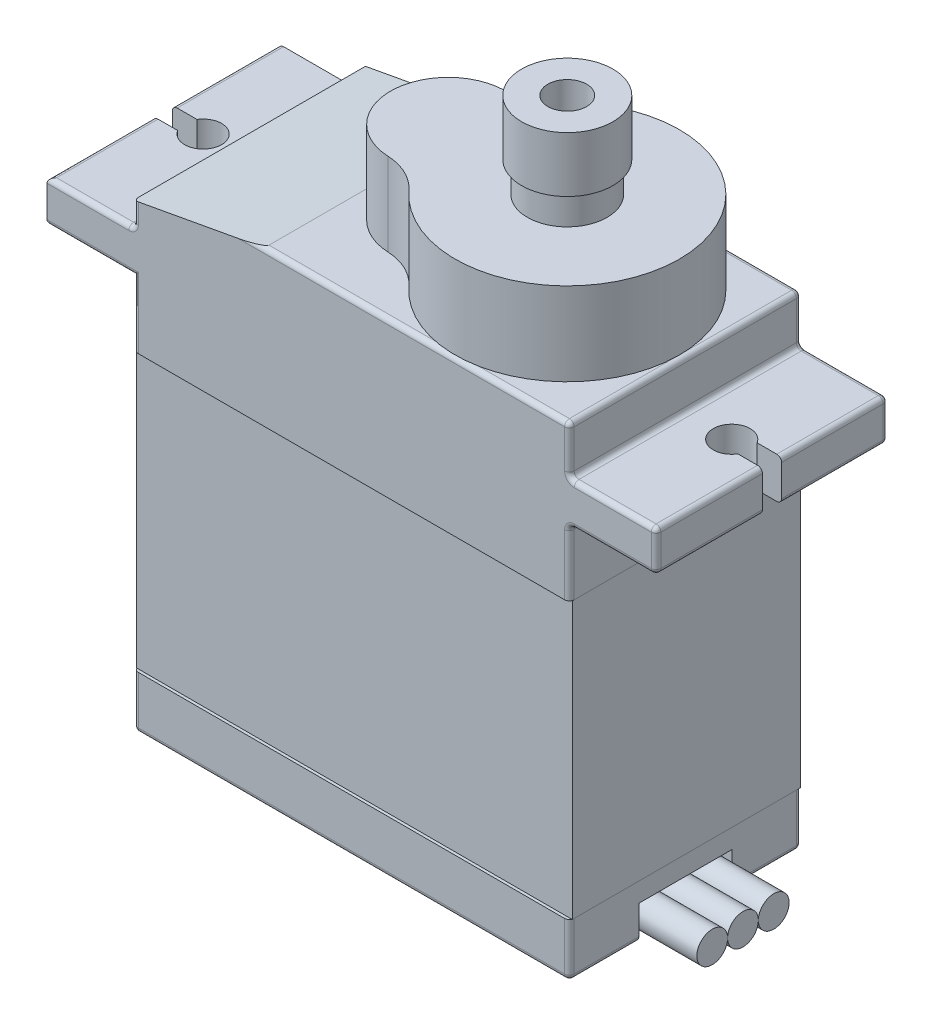
from build123d import *

# Parameters (mm, degrees)
CROQUIS1_W                   = 22.67
CROQUIS1_H                   = 12.06
SALIENTE_EXTRUIR1_DEPTH      = 25.15
CROQUIS2_W                   = 12.06
CROQUIS2_H                   = 2.13
SALIENTE_EXTRUIR2_DEPTH      = 4.51
CROQUIS5_W                   = 12.06
CROQUIS5_H                   = 2.13
SALIENTE_EXTRUIR3_DEPTH      = 4.51
REDONDEO1_R                  = 0.25
CORTAR_EXTRUIR12_DEPTH       = 4.51
SALIENTE_EXTRUIR4_DEPTH      = 4.32
CROQUIS9_R                   = 2.075
SALIENTE_EXTRUIR5_DEPTH      = 1.58
CROQUIS10_R                  = 2.385
SALIENTE_EXTRUIR6_DEPTH      = 2.88
CROQUIS11_R                  = 1.01
CORTAR_EXTRUIR13_DEPTH       = 3.88
CROQUIS12_R                  = 2.385
CROQUIS12_R_2                = 2.375
CORTAR_EXTRUIR14_DEPTH       = 2.88
CORTAR_EXTRUIR15_DEPTH       = 16.88
CROQUIS14_W                  = 22.17
CROQUIS14_H                  = 14.33
CORTAR_EXTRUIR16_DEPTH       = 16.88
CROQUIS16_W                  = 11.56
CROQUIS16_H                  = 14.354716837
CORTAR_EXTRUIR17_DEPTH       = 27.88
CORTAR_EXTRUIR18_DEPTH       = 27.88
CORTAR_EXTRUIR18_DEPTH_BACK  = 27.88
CROQUIS17_W                  = 22.67
CROQUIS17_H                  = 14.354716837
SALIENTE_EXTRUIR7_DEPTH      = 5.88
SALIENTE_EXTRUIR7_DEPTH_BACK = 6
CROQUIS18_W                  = 22.67
CROQUIS18_H                  = 14.354716837
CROQUIS19_W                  = 4.84
CROQUIS19_H                  = 1.754840309
CORTAR_EXTRUIR19_DEPTH       = 1.6
SALIENTE_EXTRUIR8_DEPTH      = 4.6
CROQUIS20_R                  = 0.8
SALIENTE_EXTRUIR8_2_DEPTH    = 4.6
SALIENTE_EXTRUIR8_3_DEPTH    = 4.6


with BuildPart() as part:
    # Croquis1 → Saliente-Extruir1 (new body)
    with BuildSketch(Plane(origin=(0, 0, 0), x_dir=(1, 0, 0), z_dir=(0, 1, 0))):
        Rectangle(CROQUIS1_W, CROQUIS1_H)
    extrude(amount=SALIENTE_EXTRUIR1_DEPTH)

    # Croquis2 → Saliente-Extruir2 (add)
    with BuildSketch(Plane(origin=(11.335, 0, 0), x_dir=(0, 0, -1), z_dir=(1, 0, 0))):
        with Locations((0, 21.595)):
            Rectangle(CROQUIS2_W, CROQUIS2_H)
    extrude(amount=SALIENTE_EXTRUIR2_DEPTH)

    # Croquis5 → Saliente-Extruir3 (add)
    with BuildSketch(Plane.ZY.offset(11.335)):
        with Locations((0, 21.595)):
            Rectangle(CROQUIS5_W, CROQUIS5_H)
    extrude(amount=SALIENTE_EXTRUIR3_DEPTH)

    # Redondeo1
    redondeo1_edges = [part.edges().sort_by_distance(p)[0] for p in [
        (-11.335, 23.905, 6.03),
        (11.335, 10.265, 6.03),
        (11.335, 23.905, 6.03),
        (11.335, 23.905, -6.03),
        (11.335, 10.265, -6.03),
        (11.335, 0, 0),
        (0, 0, -6.03),
        (0, 0, 6.03),
        (-11.335, 0, 0),
        (-11.335, 10.265, -6.03),
        (-11.335, 10.265, 6.03),
        (-13.59, 20.53, 6.03),
        (-13.59, 22.66, 6.03),
        (0, 25.15, -6.03),
        (0, 25.15, 6.03),
        (-11.335, 22.66, 0),
        (-11.335, 25.15, 0),
        (11.335, 25.15, 0),
        (13.59, 20.53, 6.03),
        (13.59, 22.66, 6.03),
        (13.59, 22.66, -6.03),
        (13.59, 20.53, -6.03),
        (11.335, 20.53, 0),
        (11.335, 22.66, 0),
        (15.845, 21.595, -6.03),
        (15.845, 21.595, 6.03),
        (15.845, 20.53, 0),
        (15.845, 22.66, 0),
        (-15.845, 20.53, 0),
        (-15.845, 22.66, 0),
    ]]
    fillet(redondeo1_edges, radius=REDONDEO1_R)

    # Croquis6 → Cortar-Extruir12 (cut)
    with BuildSketch(Plane(origin=(0, 22.66, 0), x_dir=(1, 0, 0), z_dir=(0, 1, 0))):
        with BuildLine():
            Line((-14.56951205, 0.5), (-16.56951205, 0.5))
            Line((-16.56951205, 0.5), (-16.56951205, -0.5))
            Line((-16.56951205, -0.5), (-14.56951205, -0.5))
            ThreePointArc((-14.56951205, -0.5), (-12.79, 0), (-14.56951205, 0.5))
        make_face()
        with BuildLine():
            Line((14.56951205, 0.5), (16.56951205, 0.5))
            Line((16.56951205, 0.5), (16.56951205, -0.5))
            Line((16.56951205, -0.5), (14.56951205, -0.5))
            ThreePointArc((14.56951205, -0.5), (12.79, 0), (14.56951205, 0.5))
        make_face()
    extrude(amount=-CORTAR_EXTRUIR12_DEPTH, mode=Mode.SUBTRACT)

    # Croquis13 → Cortar-Extruir15 (cut)
    with BuildSketch(Plane.XY.offset(6.03)):
        Polygon((-4.540532383, 25.15), (-11.335, 23.905), (-11.335, 25.15), align=None)
    extrude(amount=-CORTAR_EXTRUIR15_DEPTH, mode=Mode.SUBTRACT)

    # Croquis14 → Cortar-Extruir16 (cut)
    with BuildSketch(Plane.XY.offset(6.03)):
        with Locations((0, 9.935)):
            Rectangle(CROQUIS14_W, CROQUIS14_H)
    extrude(amount=-CORTAR_EXTRUIR16_DEPTH, mode=Mode.SUBTRACT)

    # Croquis16 → Cortar-Extruir17 (cut)
    with BuildSketch(Plane.ZY.offset(11.335)):
        with Locations((0, 9.932198727)):
            Rectangle(CROQUIS16_W, CROQUIS16_H)
    extrude(amount=-CORTAR_EXTRUIR17_DEPTH, mode=Mode.SUBTRACT)

    # Croquis17 → Cortar-Extruir18 (cut, two sides: drawn at the far end of the back side and taken through both)
    with BuildSketch(Plane.XY.offset(-CORTAR_EXTRUIR18_DEPTH_BACK)):
        with Locations((0, 9.932198727)):
            Rectangle(CROQUIS17_W, CROQUIS17_H)
    extrude(amount=CORTAR_EXTRUIR18_DEPTH + CORTAR_EXTRUIR18_DEPTH_BACK, mode=Mode.SUBTRACT)


with BuildPart() as body_2:
    # Croquis8 → Saliente-Extruir4 (new body)
    with BuildSketch(Plane(origin=(0, 25.15, 0), x_dir=(1, 0, 0), z_dir=(0, 1, 0))):
        with BuildLine():
            ThreePointArc((0.929343711, -3.976626478), (11.084774082, -0.106346012), (0.999028124, 3.942056806))
            ThreePointArc((0.999028124, 3.942056806), (0.046671675, 3.262297983), (-1.093280765, 2.998549432))
            ThreePointArc((-1.093280765, 2.998549432), (-3.999883847, 0.026398978), (-1.146036702, -2.996443439))
            ThreePointArc((-1.146036702, -2.996443439), (-0.01090242, -3.280212753), (0.929343711, -3.976626478))
        make_face()
    extrude(amount=SALIENTE_EXTRUIR4_DEPTH)


with BuildPart() as body_3:
    # Croquis9 → Saliente-Extruir5 (new body)
    with BuildSketch(Plane(origin=(0, 29.47, 0), x_dir=(1, 0, 0), z_dir=(0, 1, 0))):
        with Locations((5.25, -0.055)):
            Circle(CROQUIS9_R)
    extrude(amount=SALIENTE_EXTRUIR5_DEPTH)


with BuildPart() as body_4:
    # Croquis10 → Saliente-Extruir6 (new body)
    with BuildSketch(Plane(origin=(0, 31.05, 0), x_dir=(1, 0, 0), z_dir=(0, 1, 0))):
        with Locations((5.25, -0.055)):
            Circle(CROQUIS10_R)
    extrude(amount=SALIENTE_EXTRUIR6_DEPTH)


with BuildPart() as cortar_extruir13_tool:
    # Croquis11 → Cortar-Extruir13 (new body)
    with BuildSketch(Plane(origin=(0, 33.93, 0), x_dir=(1, 0, 0), z_dir=(0, 1, 0))):
        with Locations((5.25, -0.055)):
            Circle(CROQUIS11_R)
    extrude(amount=-CORTAR_EXTRUIR13_DEPTH)


with BuildPart() as body_3_1:
    add(body_3.part)

    # Cortar-Extruir13: cut by cortar_extruir13_tool
    add(cortar_extruir13_tool.part, mode=Mode.SUBTRACT)


with BuildPart() as body_4_1:
    add(body_4.part)

    # Cortar-Extruir13: cut by cortar_extruir13_tool
    add(cortar_extruir13_tool.part, mode=Mode.SUBTRACT)

    # Croquis12 → Cortar-Extruir14 (cut)
    with BuildSketch(Plane(origin=(0, 33.93, 0), x_dir=(1, 0, 0), z_dir=(0, 1, 0))):
        with Locations((5.25, -0.055)):
            Circle(CROQUIS12_R)
        with Locations((5.25, -0.055)):
            Circle(CROQUIS12_R_2, mode=Mode.SUBTRACT)
    extrude(amount=-CORTAR_EXTRUIR14_DEPTH, mode=Mode.SUBTRACT)


with BuildPart() as cortar_extruir18_piece_1:
    # of the separate pieces the step leaves, piece 1, a body of its own (cortar_extruir18_pieces)
    add(part.part.solids().sort_by_distance((-11.085, 17.109557146, -6.03))[0])


with BuildPart() as cortar_extruir18_piece_2:
    # of the separate pieces the step leaves, piece 2, a body of its own (cortar_extruir18_pieces)
    add(part.part.solids().sort_by_distance((11.085, 0.25, -6.03))[0])

    # Croquis19 → Cortar-Extruir19 (cut)
    with BuildSketch(Plane(origin=(11.335, 0, 0), x_dir=(0, 0, -1), z_dir=(1, 0, 0))):
        with Locations((0, 0.877420155)):
            Rectangle(CROQUIS19_W, CROQUIS19_H)
    extrude(amount=-CORTAR_EXTRUIR19_DEPTH, mode=Mode.SUBTRACT)


with BuildPart() as body_6:
    # Croquis18 → Saliente-Extruir7 (new, two sides: drawn at the far end of the back side and taken through both)
    with BuildSketch(Plane.XY.offset(-SALIENTE_EXTRUIR7_DEPTH_BACK)):
        with Locations((0, 9.932198727)):
            Rectangle(CROQUIS18_W, CROQUIS18_H)
    extrude(amount=SALIENTE_EXTRUIR7_DEPTH + SALIENTE_EXTRUIR7_DEPTH_BACK)


with BuildPart() as body_7:
    # Croquis20 → Saliente-Extruir8 (new body)
    with BuildSketch(Plane(origin=(9.735, 0, 0), x_dir=(0, 0, -1), z_dir=(1, 0, 0))):
        with BuildLine():
            ThreePointArc((-0.8, 0.877420155), (0, 0.077420155), (0.8, 0.877420155))
            ThreePointArc((0.8, 0.877420155), (0, 1.677420155), (-0.8, 0.877420155))
        make_face()
    extrude(amount=SALIENTE_EXTRUIR8_DEPTH)


with BuildPart() as body_8:
    # Croquis20 → Saliente-Extruir8 2 (new body)
    with BuildSketch(Plane(origin=(9.735, 0, 0), x_dir=(0, 0, -1), z_dir=(1, 0, 0))):
        with Locations((-1.6, 0.877420155)):
            Circle(CROQUIS20_R)
    extrude(amount=SALIENTE_EXTRUIR8_2_DEPTH)


with BuildPart() as body_9:
    # Croquis20 → Saliente-Extruir8 3 (new body)
    with BuildSketch(Plane(origin=(9.735, 0, 0), x_dir=(0, 0, -1), z_dir=(1, 0, 0))):
        with Locations((1.6, 0.877420155)):
            Circle(CROQUIS20_R)
    extrude(amount=SALIENTE_EXTRUIR8_3_DEPTH)


solid = Compound([body_2.part, body_3_1.part, body_4_1.part, cortar_extruir18_piece_1.part, cortar_extruir18_piece_2.part, body_6.part, body_7.part, body_8.part, body_9.part])
